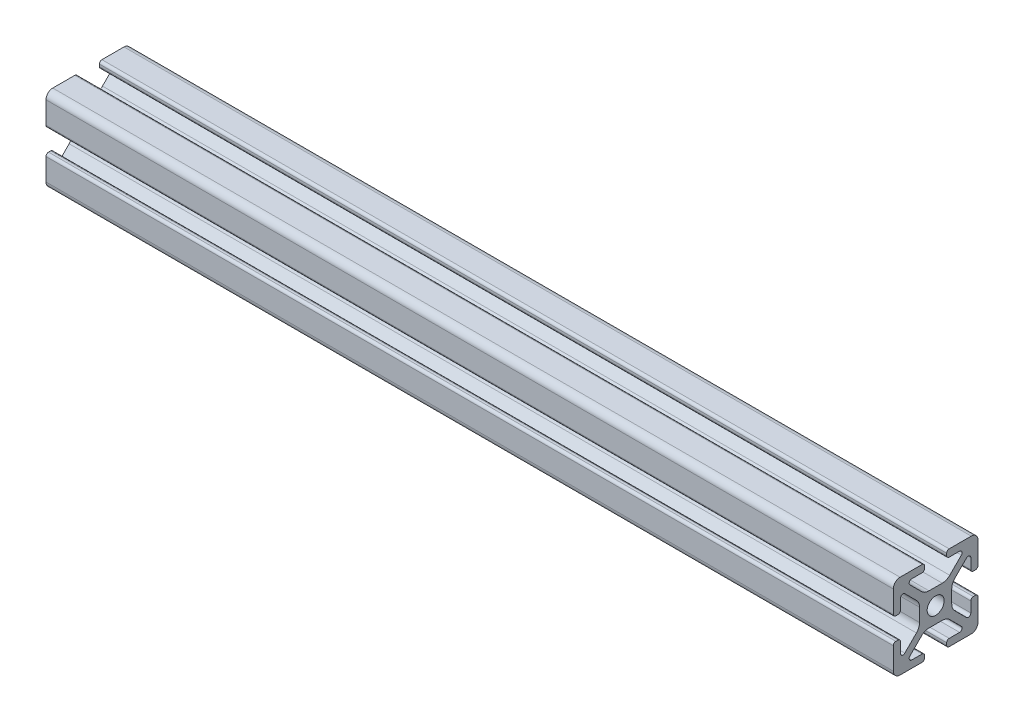
from build123d import *

# Parameters (mm, degrees)
BOSS_EXTRUDE1_DEPTH      = 127
BOSS_EXTRUDE1_DEPTH_BACK = 127


with BuildPart() as part:
    # Sketch3 → Boss-Extrude1 (new, two sides: drawn at the far end of the back side and taken through both)
    with BuildSketch(Plane(origin=(0, 0, 0), x_dir=(0, 0, -1), z_dir=(1, 0, 0)).offset(-BOSS_EXTRUDE1_DEPTH_BACK)):
        with BuildLine():
            Line((0, 4.826), (1.984228399, 4.826))
            ThreePointArc((1.984228399, 4.826), (3.199248297, 5.067682484), (4.229292429, 5.75593597))
            Line((4.229292429, 5.75593597), (7.713541092, 9.240184633))
            ThreePointArc((7.713541092, 9.240184633), (7.878721929, 10.070604775), (7.174725725, 10.541))
            Line((7.174725725, 10.541), (4.064, 10.541))
            ThreePointArc((4.064, 10.541), (3.525184633, 10.764184633), (3.302, 11.303))
            Line((3.302, 11.303), (3.302, 11.938))
            ThreePointArc((3.302, 11.938), (3.525184633, 12.476815367), (4.064, 12.7))
            Line((4.064, 12.7), (10.668, 12.7))
            ThreePointArc((10.668, 12.7), (12.104840979, 12.104840979), (12.7, 10.668))
            Line((12.7, 10.668), (12.7, 4.064))
            ThreePointArc((12.7, 4.064), (12.476815367, 3.525184633), (11.938, 3.302))
            Line((11.938, 3.302), (11.303, 3.302))
            ThreePointArc((11.303, 3.302), (10.764184633, 3.525184633), (10.541, 4.064))
            Line((10.541, 4.064), (10.541, 7.174725725))
            ThreePointArc((10.541, 7.174725725), (10.070604775, 7.878721929), (9.240184633, 7.713541092))
            Line((9.240184633, 7.713541092), (5.75593597, 4.229292429))
            ThreePointArc((5.75593597, 4.229292429), (5.067682484, 3.199248297), (4.826, 1.984228399))
            Line((4.826, 1.984228399), (4.826, 0))
            Line((4.826, 0), (2.54, 0))
            ThreePointArc((2.54, 0), (1.796051224, 1.796051224), (0, 2.54))
            Line((0, 2.54), (0, 4.826))
        make_face()
    extrude(amount=BOSS_EXTRUDE1_DEPTH + BOSS_EXTRUDE1_DEPTH_BACK)

    # Mirror1: part across plane


with BuildPart() as part_1:
    add(part.part)
    add(part.part.mirror(Plane.ZX))

    # Mirror2: part across plane


with BuildPart() as part_2:
    add(part_1.part)
    add(part_1.part.mirror(Plane.XY))


solid = part_2.part
